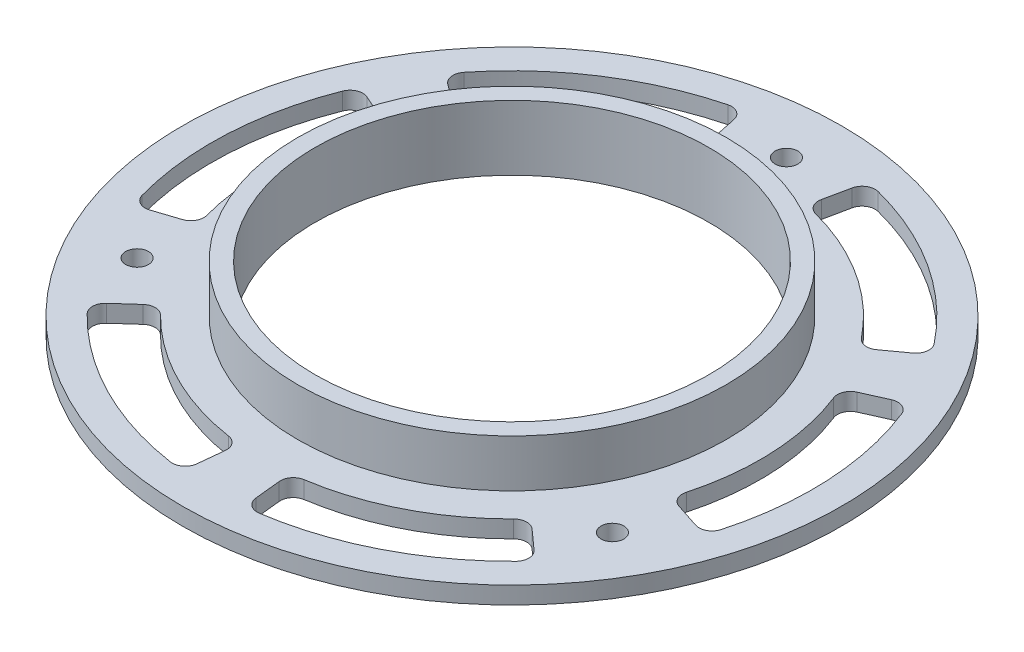
from build123d import *

# Parameters (mm, degrees)
SKETCH1_R               = 76.2
SKETCH1_R_2             = 45.53
BOSS_EXTRUDE1_DEPTH     = 4
CUT_EXTRUDE1_DEPTH      = 108.837284832
CUT_EXTRUDE1_DEPTH_BACK = 108.837284832
SKETCH10_R              = 2.625
CUT_EXTRUDE5_DEPTH      = 6
FILLET1_R               = 3
SKETCH1_12_R            = 49.53
SKETCH1_12_R_2          = 45.53
BOSS_EXTRUDE2_DEPTH     = 15


with BuildPart() as part:
    # Sketch1 → Boss-Extrude1 (new body)
    with BuildSketch(Plane(origin=(0, 0, 0), x_dir=(1, 0, 0), z_dir=(0, 1, 0))):
        Circle(SKETCH1_R)
        Circle(SKETCH1_R_2, mode=Mode.SUBTRACT)
    extrude(amount=BOSS_EXTRUDE1_DEPTH)

    # Sketch1<7> → Cut-Extrude1 (cut, two sides: drawn at the far end of the back side and taken through both)
    with BuildSketch(Plane(origin=(0, 0, 0), x_dir=(1, 0, 0), z_dir=(0, 1, 0)).offset(-CUT_EXTRUDE1_DEPTH_BACK)):
        with BuildLine():
            Line((-11.835953591, 56.235431525), (-14.307462584, 67.978158777))
            ThreePointArc((-14.307462584, 67.978158777), (-37.821938213, 58.268641189), (-56.263908611, 40.744400156))
            Line((-56.263908611, 40.744400156), (-46.544731969, 33.706104523))
            ThreePointArc((-46.544731969, 33.706104523), (-31.288476399, 48.203161731), (-11.835953591, 56.235431525))
        make_face()
        with BuildLine():
            ThreePointArc((56.263908611, 40.744400156), (37.821938213, 58.268641189), (14.307462584, 67.978158777))
            Line((14.307462584, 67.978158777), (11.835953591, 56.235431525))
            ThreePointArc((11.835953591, 56.235431525), (31.288476399, 48.203161731), (46.544731969, 33.706104523))
            Line((46.544731969, 33.706104523), (56.263908611, 40.744400156))
        make_face()
        with BuildLine():
            Line((-52.462708765, 23.455868036), (-63.417639903, 28.353774095))
            ThreePointArc((-63.417639903, 28.353774095), (-69.373092621, 3.620438719), (-66.024543695, -21.598453327))
            Line((-66.024543695, -21.598453327), (-54.619289089, -17.867479275))
            ThreePointArc((-54.619289089, -17.867479275), (-57.389400801, 2.995034542), (-52.462708765, 23.455868036))
        make_face()
        with BuildLine():
            ThreePointArc((66.024543695, -21.598453327), (69.373092621, 3.620438719), (63.417639903, 28.353774095))
            Line((63.417639903, 28.353774095), (52.462708765, 23.455868036))
            ThreePointArc((52.462708765, 23.455868036), (57.389400801, 2.995034542), (54.619289089, -17.867479275))
            Line((54.619289089, -17.867479275), (66.024543695, -21.598453327))
        make_face()
        with BuildLine():
            Line((-42.783335499, -38.36795225), (-51.717081111, -46.37970545))
            ThreePointArc((-51.717081111, -46.37970545), (-31.551154407, -61.889079908), (-7.153731292, -69.098174251))
            Line((-7.153731292, -69.098174251), (-5.917976795, -57.16197256))
            ThreePointArc((-5.917976795, -57.16197256), (-26.100924402, -51.198196273), (-42.783335499, -38.36795225))
        make_face()
        with BuildLine():
            ThreePointArc((7.153731292, -69.098174251), (31.551154407, -61.889079908), (51.717081111, -46.37970545))
            Line((51.717081111, -46.37970545), (42.783335499, -38.36795225))
            ThreePointArc((42.783335499, -38.36795225), (26.100924402, -51.198196273), (5.917976795, -57.16197256))
            Line((5.917976795, -57.16197256), (7.153731292, -69.098174251))
        make_face()
    extrude(amount=CUT_EXTRUDE1_DEPTH + CUT_EXTRUDE1_DEPTH_BACK, mode=Mode.SUBTRACT)

    # Sketch10 → Cut-Extrude5 (cut)
    with BuildSketch(Plane(origin=(0, 4, 0), x_dir=(1, 0, 0), z_dir=(0, 1, 0))):
        with Locations((0, 63.4675)):
            Circle(SKETCH10_R)
        with Locations((54.964467315, -31.73375)):
            Circle(SKETCH10_R)
        with Locations((-54.964467315, -31.73375)):
            Circle(SKETCH10_R)
    extrude(amount=-CUT_EXTRUDE5_DEPTH, mode=Mode.SUBTRACT)

    # Fillet1
    fillet1_edges = [part.edges().sort_by_distance(p)[0] for p in [
        (-14.307462584, 2, -67.978158777),
        (-56.263908611, 2, -40.744400156),
        (-51.717081111, 2, 46.37970545),
        (11.835953591, 2, -56.235431525),
        (46.544731969, 2, -33.706104523),
        (7.153731292, 2, 69.098174251),
        (54.619289089, 2, 17.867479275),
        (-66.024543695, 2, 21.598453327),
        (66.024543695, 2, 21.598453327),
        (-7.153731292, 2, 69.098174251),
        (-46.544731969, 2, -33.706104523),
        (56.263908611, 2, -40.744400156),
        (-11.835953591, 2, -56.235431525),
        (-54.619289089, 2, 17.867479275),
        (-52.462708765, 2, -23.455868036),
        (51.717081111, 2, 46.37970545),
        (-5.917976795, 2, 57.16197256),
        (63.417639903, 2, -28.353774095),
        (-42.783335499, 2, 38.36795225),
        (42.783335499, 2, 38.36795225),
        (-63.417639903, 2, -28.353774095),
        (5.917976795, 2, 57.16197256),
        (52.462708765, 2, -23.455868036),
        (14.307462584, 2, -67.978158777),
    ]]
    fillet(fillet1_edges, radius=FILLET1_R)

    # Sketch1<12> → Boss-Extrude2 (add)
    with BuildSketch(Plane(origin=(0, 0, 0), x_dir=(1, 0, 0), z_dir=(0, 1, 0))):
        Circle(SKETCH1_12_R)
        Circle(SKETCH1_12_R_2, mode=Mode.SUBTRACT)
    extrude(amount=BOSS_EXTRUDE2_DEPTH)


solid = part.part
